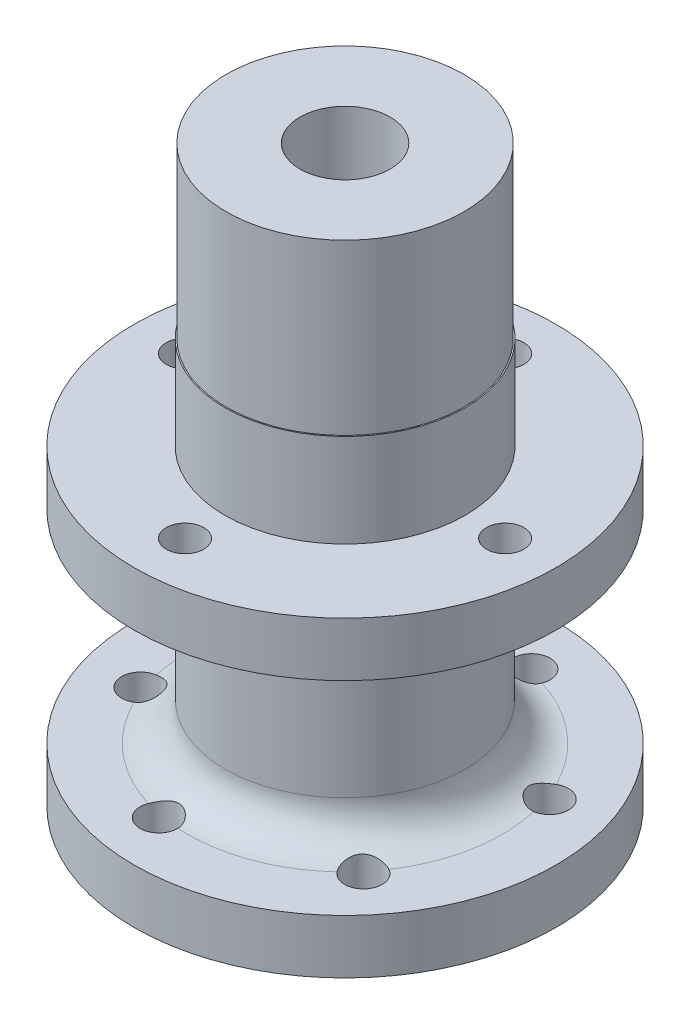
from build123d import *

# Parameters (mm, degrees)
SCHIZZO1_R                    = 14.03
ESTRUSIONE_ESTRUSIONE1_DEPTH  = 3.6
SCHIZZO2_R                    = 7.98
ESTRUSIONE_ESTRUSIONE2_DEPTH  = 13.53
SCHIZZO3_R                    = 14.03
ESTRUSIONE_ESTRUSIONE3_DEPTH  = 3.6
SCHIZZO4_R                    = 7.995
ESTRUSIONE_ESTRUSIONE4_DEPTH  = 6.2
ESTRUSIONE_ESTRUSIONE5_START  = 1.95
SCHIZZO5_R                    = 7.995
ESTRUSIONE_ESTRUSIONE5_DEPTH  = 1.95
SCHIZZO6_R                    = 7.915
ESTRUSIONE_ESTRUSIONE6_DEPTH  = 11.25
RACCORDO1_R                   = 2.5
FORO_FILETTATO_M3X0_5_1_D     = 2.5
FORO_FILETTATO_M3X0_5_1_DEPTH = 6.1
FORO_FILETTATO_M3X0_5_1_TIP   = 0.751075774
SCHIZZO10_R                   = 3
TAGLIO_ESTRUSIONE1_DEPTH      = 45.767160955
FORO_FILETTATO_M3X0_5_2_D     = 2.5
FORO_FILETTATO_M3X0_5_2_DEPTH = 8.5
FORO_FILETTATO_M3X0_5_2_TIP   = 0.751075774


with BuildPart() as part:
    # Schizzo1 → Estrusione-Estrusione1 (new body)
    with BuildSketch(Plane(origin=(0, 0, 0), x_dir=(1, 0, 0), z_dir=(0, 1, 0))):
        with Locations(Location((0, 0, 0), (0, 0, 270))):
            Circle(SCHIZZO1_R)
    extrude(amount=ESTRUSIONE_ESTRUSIONE1_DEPTH)

    # Schizzo2 → Estrusione-Estrusione2 (add)
    with BuildSketch(Plane(origin=(0, 3.6, 0), x_dir=(1, 0, 0), z_dir=(0, 1, 0))):
        with Locations(Location((0, 0, 0), (0, 0, 270))):
            Circle(SCHIZZO2_R)
    extrude(amount=ESTRUSIONE_ESTRUSIONE2_DEPTH)

    # Schizzo3 → Estrusione-Estrusione3 (add)
    with BuildSketch(Plane(origin=(0, 17.13, 0), x_dir=(1, 0, 0), z_dir=(0, 1, 0))):
        with Locations(Location((0, 0, 0), (0, 0, 270))):
            Circle(SCHIZZO3_R)
    extrude(amount=ESTRUSIONE_ESTRUSIONE3_DEPTH)

    # Schizzo4 → Estrusione-Estrusione4 (add)
    with BuildSketch(Plane(origin=(0, 20.73, 0), x_dir=(1, 0, 0), z_dir=(0, 1, 0))):
        with Locations(Location((0, 0, 0), (0, 0, 90))):
            Circle(SCHIZZO4_R)
    extrude(amount=ESTRUSIONE_ESTRUSIONE4_DEPTH)

    # Schizzo5 → Estrusione-Estrusione5 (add)
    with BuildSketch(Plane.XZ.offset(ESTRUSIONE_ESTRUSIONE5_START)):
        with Locations(Location((0, 0, 0), (0, 0, 270))):
            Circle(SCHIZZO5_R)
    extrude(amount=-ESTRUSIONE_ESTRUSIONE5_DEPTH)

    # Schizzo6 → Estrusione-Estrusione6 (add)
    with BuildSketch(Plane(origin=(0, 26.93, 0), x_dir=(1, 0, 0), z_dir=(0, 1, 0))):
        with Locations(Location((0, 0, 0), (0, 0, 90))):
            Circle(SCHIZZO6_R)
    extrude(amount=ESTRUSIONE_ESTRUSIONE6_DEPTH)

    # Raccordo1
    raccordo1_edges = [part.edges().sort_by_distance(p)[0] for p in [
        (0, 3.6, -7.98),
        (0, 17.13, -7.98),
    ]]
    fillet(raccordo1_edges, radius=RACCORDO1_R)

    # Foro filettato M3x0.5-1
    with Locations(Plane(origin=(0, 20.73, 0), x_dir=(1, 0, 0), z_dir=(0, 1, 0))):
        with Locations((0, 10.65), (10.65, 0), (-10.65, 0), (0, -10.65)):
            Hole(FORO_FILETTATO_M3X0_5_1_D / 2, depth=FORO_FILETTATO_M3X0_5_1_DEPTH)
            with Locations((0, 0, -(FORO_FILETTATO_M3X0_5_1_DEPTH + FORO_FILETTATO_M3X0_5_1_TIP / 2))):  # 118° drill point
                Cone(0, FORO_FILETTATO_M3X0_5_1_D / 2, FORO_FILETTATO_M3X0_5_1_TIP, mode=Mode.SUBTRACT)

    # Schizzo10 → Taglio-Estrusione1 (cut, through all)
    with BuildSketch(Plane(origin=(0, 38.18, 0), x_dir=(1, 0, 0), z_dir=(0, 1, 0))):
        with Locations(Location((0, 0, 0), (0, 0, 270))):
            Circle(SCHIZZO10_R)
    extrude(amount=-TAGLIO_ESTRUSIONE1_DEPTH, mode=Mode.SUBTRACT)

    # Foro filettato M3x0.5-2
    with Locations(Plane(origin=(0, 0, 0), x_dir=(-1, 0, 0), z_dir=(0, -1, 0))):
        with Locations((-10.030128499, 3.580366224), (-1.914376144, 10.476529195), (8.115752354, 6.896162971), (10.030128499, -3.580366224), (1.914376144, -10.476529195), (-8.115752354, -6.896162971), (0, 0)):
            Hole(FORO_FILETTATO_M3X0_5_2_D / 2, depth=FORO_FILETTATO_M3X0_5_2_DEPTH)
            with Locations((0, 0, -(FORO_FILETTATO_M3X0_5_2_DEPTH + FORO_FILETTATO_M3X0_5_2_TIP / 2))):  # 118° drill point
                Cone(0, FORO_FILETTATO_M3X0_5_2_D / 2, FORO_FILETTATO_M3X0_5_2_TIP, mode=Mode.SUBTRACT)


solid = part.part
